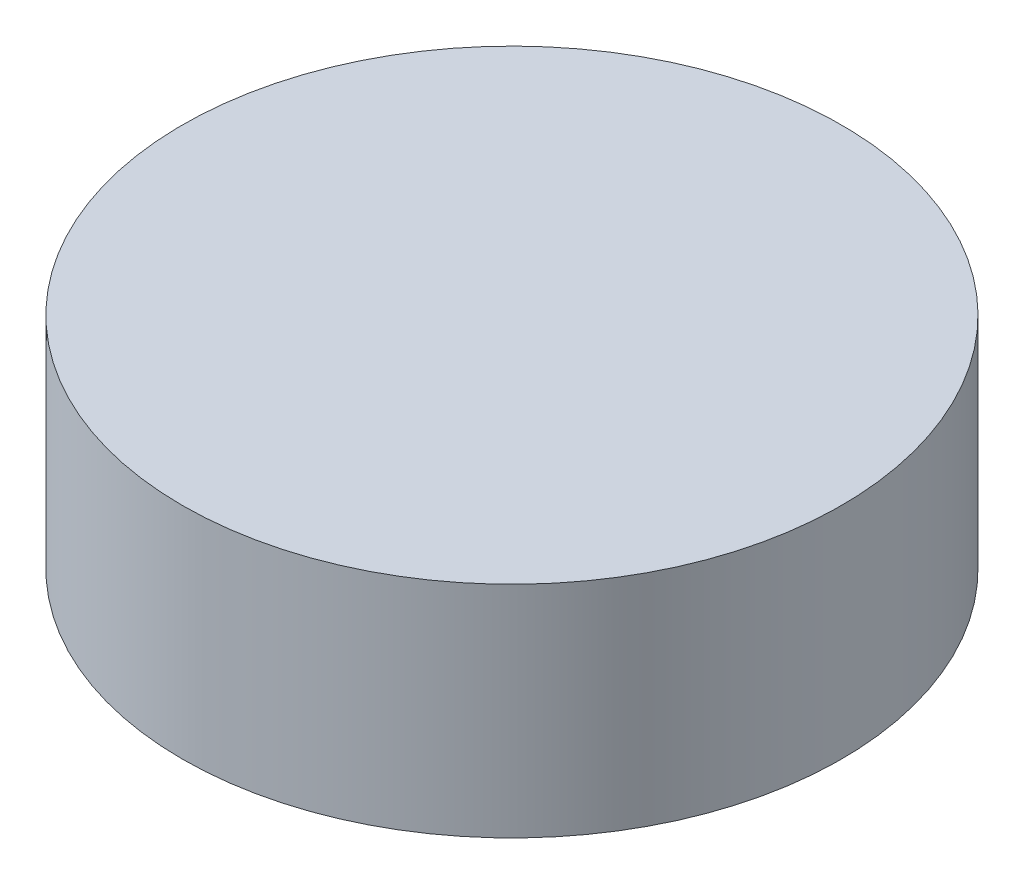
from build123d import *

# Parameters (mm, degrees)
SKETCH1_R           = 15
BOSS_EXTRUDE1_DEPTH = 10


with BuildPart() as part:
    # Sketch1 → Boss-Extrude1 (new body)
    with BuildSketch(Plane(origin=(0, 0, 0), x_dir=(1, 0, 0), z_dir=(0, 1, 0))):
        with Locations(Location((0, 0, 0), (0, 0, 270))):
            Circle(SKETCH1_R)
    extrude(amount=BOSS_EXTRUDE1_DEPTH)


solid = part.part
